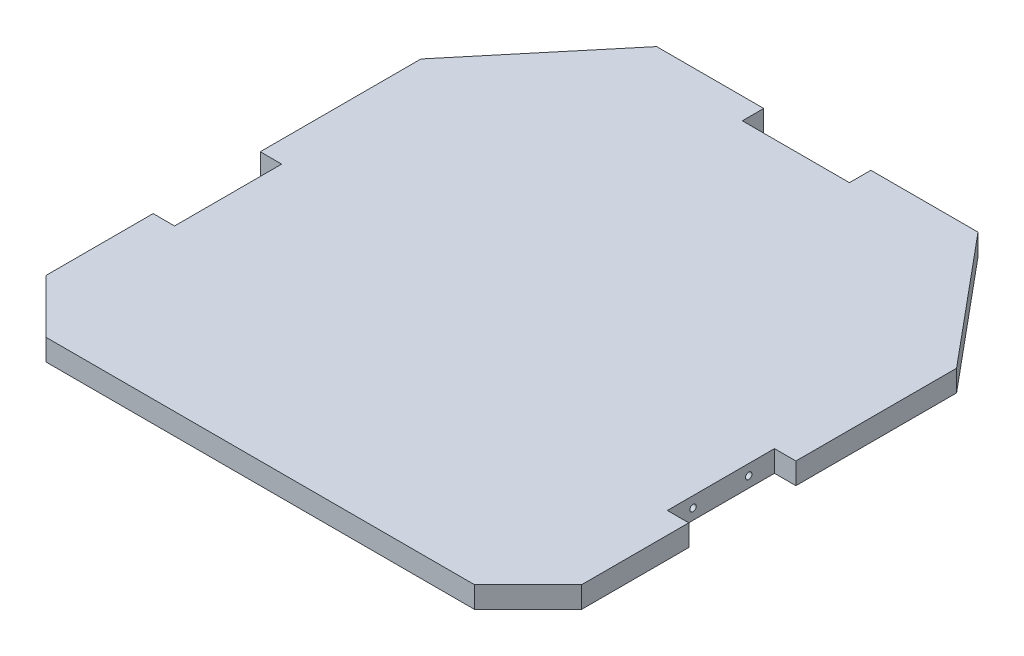
from build123d import *

# Parameters (mm, degrees)
BOSS_EXTRUDE1_DEPTH = 10
SKETCH2_R           = 1.5
CUT_EXTRUDE1_DEPTH  = 15
SKETCH3_R           = 1.5
CUT_EXTRUDE2_DEPTH  = 15


with BuildPart() as part:
    # Sketch1 → Boss-Extrude1 (new body)
    with BuildSketch(Plane(origin=(0, 0, 0), x_dir=(1, 0, 0), z_dir=(0, 1, 0))):
        Polygon((-125, 200), (-125, 125), (-115, 125), (-115, 75), (-125, 75), (-125, 25), (-100, 0), (100, 0), (125, 25), (125, 75), (115, 75), (115, 125), (125, 125), (125, 200), (75, 260), (25, 260), (25, 250), (-25, 250), (-25, 260), (-75, 260), align=None)
    extrude(amount=BOSS_EXTRUDE1_DEPTH)

    # Sketch2 → Cut-Extrude1 (cut)
    with BuildSketch(Plane.ZY.offset(115)):
        with Locations((-113, 5)):
            Circle(SKETCH2_R)
        with Locations((-87, 5)):
            Circle(SKETCH2_R)
    cut_extrude1 = extrude(amount=-CUT_EXTRUDE1_DEPTH, mode=Mode.SUBTRACT)

    # Mirror1: Cut-Extrude1 across plane
    add(cut_extrude1.mirror(Plane(origin=(0, 0, 0), x_dir=(0, 0, 1), z_dir=(1, 0, 0))), mode=Mode.SUBTRACT)

    # Sketch3 → Cut-Extrude2 (cut)
    with BuildSketch(Plane(origin=(0, 0, -250), x_dir=(-1, 0, 0), z_dir=(0, 0, -1))):
        with Locations((-13, 5)):
            Circle(SKETCH3_R)
        with Locations((13, 5)):
            Circle(SKETCH3_R)
    extrude(amount=-CUT_EXTRUDE2_DEPTH, mode=Mode.SUBTRACT)


solid = part.part
